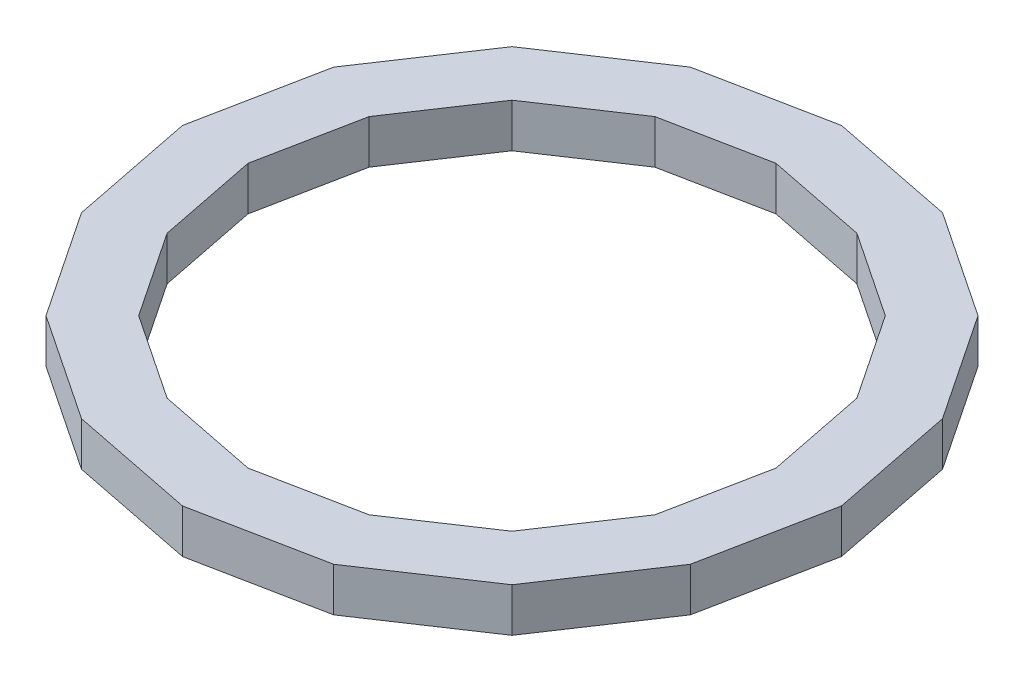
from build123d import *

# Parameters (mm, degrees)
BOSS_EXTRUDE1_DEPTH = 19.05


with BuildPart() as part:
    # Sketch1 → Boss-Extrude1 (new body)
    with BuildSketch(Plane(origin=(0, 0, 0), x_dir=(1, 0, 0), z_dir=(0, 1, 0))):
        Polygon((143.21571522, 0), (132.314068026, 54.806281469), (101.268803404, 101.268803404), (54.806281469, 132.314068026), (0, 143.21571522), (-54.806281469, 132.314068026), (-101.268803404, 101.268803404), (-132.314068026, 54.806281469), (-143.21571522, 0), (-132.314068026, -54.806281469), (-101.268803404, -101.268803404), (-54.806281469, -132.314068026), (0, -143.21571522), (54.806281469, -132.314068026), (101.268803404, -101.268803404), (132.314068026, -54.806281469), align=None)
        Polygon((114.728338259, 0), (105.995163517, 43.904634275), (81.125185978, 81.125185978), (43.904634275, 105.995163517), (0, 114.728338259), (-43.904634275, 105.995163517), (-81.125185978, 81.125185978), (-105.995163517, 43.904634275), (-114.728338259, 0), (-105.995163517, -43.904634275), (-81.125185978, -81.125185978), (-43.904634275, -105.995163517), (0, -114.728338259), (43.904634275, -105.995163517), (81.125185978, -81.125185978), (105.995163517, -43.904634275), align=None, mode=Mode.SUBTRACT)
    extrude(amount=BOSS_EXTRUDE1_DEPTH)


solid = part.part
